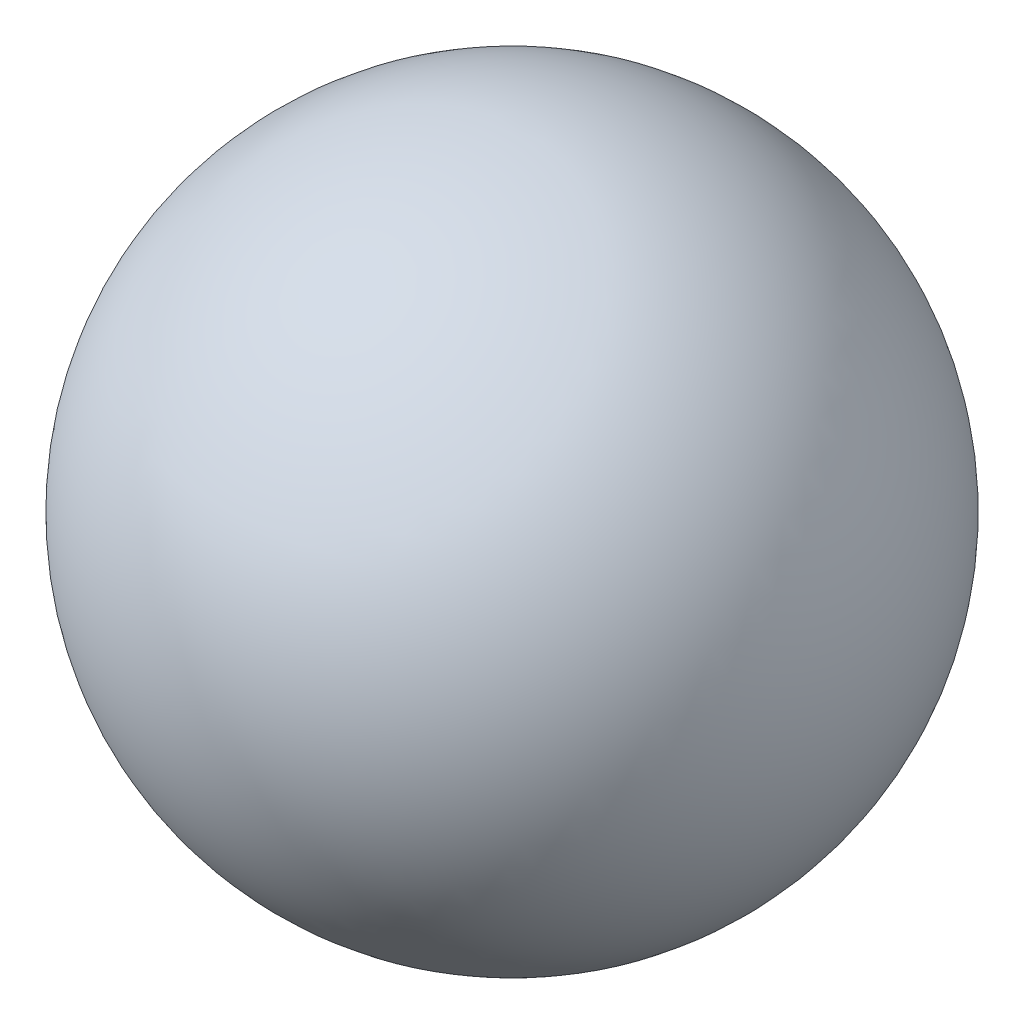
from build123d import *


with BuildPart() as part:
    # Sketch1 → Revolve3 (revolve)
    with BuildSketch(Plane.XY):
        with BuildLine():
            Line((0, 19.05), (0, -19.05))
            ThreePointArc((0, -19.05), (-19.05, 0), (0, 19.05))
        make_face()
    revolve(axis=Axis((0, 19.05, 0), (0, -1, 0)))


solid = part.part
